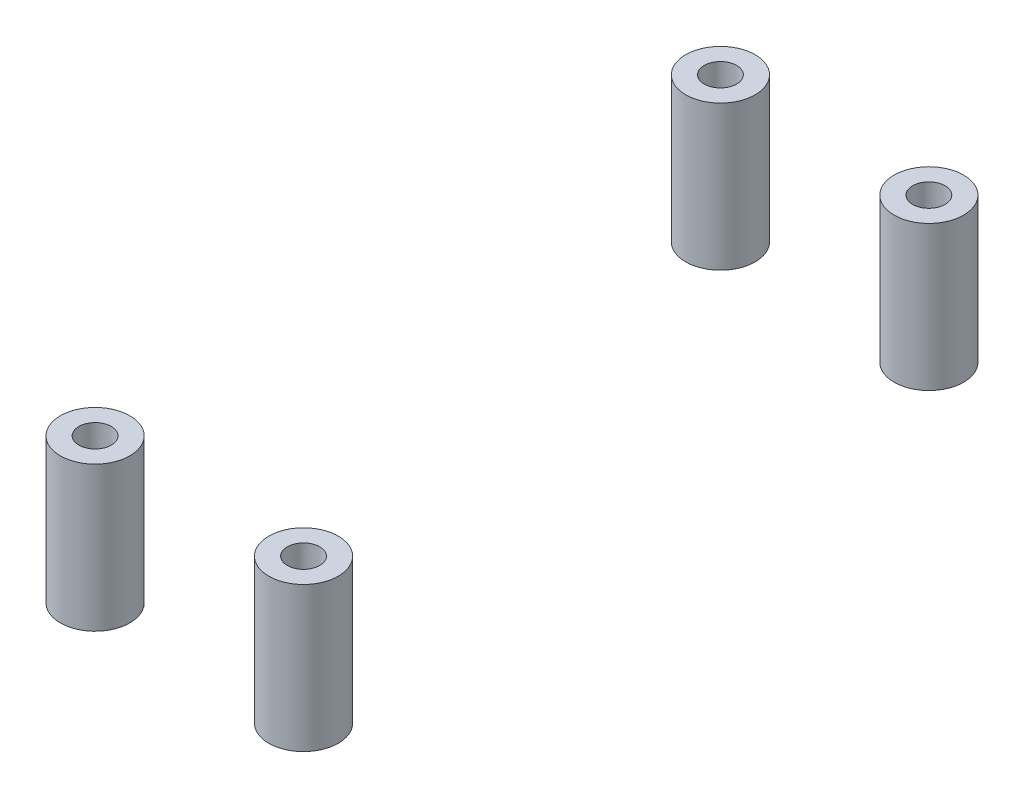
from build123d import *

# Parameters (mm, degrees)
SKETCH1_R             = 3
BOSS_EXTRUDE1_DEPTH   = 12.5
BOSS_EXTRUDE1_2_DEPTH = 12.5
BOSS_EXTRUDE1_3_DEPTH = 12.5
BOSS_EXTRUDE1_4_DEPTH = 12.5
SKETCH2_R             = 1.4
CUT_EXTRUDE1_DEPTH    = 10


with BuildPart() as part:
    # Sketch1 → Boss-Extrude1 (new body)
    with BuildSketch(Plane(origin=(0, 0, 0), x_dir=(1, 0, 0), z_dir=(0, 1, 0))):
        with Locations(Location((-11.66810389, -33.577086859, 0), (0, 0, 270))):
            Circle(SKETCH1_R)
    extrude(amount=BOSS_EXTRUDE1_DEPTH)


with BuildPart() as body_2:
    # Sketch1 → Boss-Extrude1 2 (new body)
    with BuildSketch(Plane(origin=(0, 0, 0), x_dir=(1, 0, 0), z_dir=(0, 1, 0))):
        with Locations(Location((6.33189611, -33.577086859, 0), (0, 0, 270))):
            Circle(SKETCH1_R)
    extrude(amount=BOSS_EXTRUDE1_2_DEPTH)


with BuildPart() as body_3:
    # Sketch1 → Boss-Extrude1 3 (new body)
    with BuildSketch(Plane(origin=(0, 0, 0), x_dir=(1, 0, 0), z_dir=(0, 1, 0))):
        with Locations(Location((6.33189611, 20.422913141, 0), (0, 0, 270))):
            Circle(SKETCH1_R)
    extrude(amount=BOSS_EXTRUDE1_3_DEPTH)


with BuildPart() as body_4:
    # Sketch1 → Boss-Extrude1 4 (new body)
    with BuildSketch(Plane(origin=(0, 0, 0), x_dir=(1, 0, 0), z_dir=(0, 1, 0))):
        with Locations(Location((-11.66810389, 20.422913141, 0), (0, 0, 270))):
            Circle(SKETCH1_R)
    extrude(amount=BOSS_EXTRUDE1_4_DEPTH)


with BuildPart() as cut_extrude1_tool:
    # Sketch2 → Cut-Extrude1 (new body)
    with BuildSketch(Plane(origin=(0, 12.5, 0), x_dir=(1, 0, 0), z_dir=(0, 1, 0))):
        with Locations(Location((-11.66810389, 20.422913141, 0), (0, 0, 270))):
            Circle(SKETCH2_R)
        with Locations(Location((6.33189611, 20.422913141, 0), (0, 0, 270))):
            Circle(SKETCH2_R)
        with Locations(Location((6.33189611, -33.577086859, 0), (0, 0, 270))):
            Circle(SKETCH2_R)
        with Locations(Location((-11.66810389, -33.577086859, 0), (0, 0, 270))):
            Circle(SKETCH2_R)
    extrude(amount=-CUT_EXTRUDE1_DEPTH)


with BuildPart() as part_1:
    add(part.part)

    # Cut-Extrude1: cut by cut_extrude1_tool
    add(cut_extrude1_tool.part, mode=Mode.SUBTRACT)


with BuildPart() as body_2_1:
    add(body_2.part)

    # Cut-Extrude1: cut by cut_extrude1_tool
    add(cut_extrude1_tool.part, mode=Mode.SUBTRACT)


with BuildPart() as body_3_1:
    add(body_3.part)

    # Cut-Extrude1: cut by cut_extrude1_tool
    add(cut_extrude1_tool.part, mode=Mode.SUBTRACT)


with BuildPart() as body_4_1:
    add(body_4.part)

    # Cut-Extrude1: cut by cut_extrude1_tool
    add(cut_extrude1_tool.part, mode=Mode.SUBTRACT)


solid = Compound([part_1.part, body_2_1.part, body_3_1.part, body_4_1.part])
